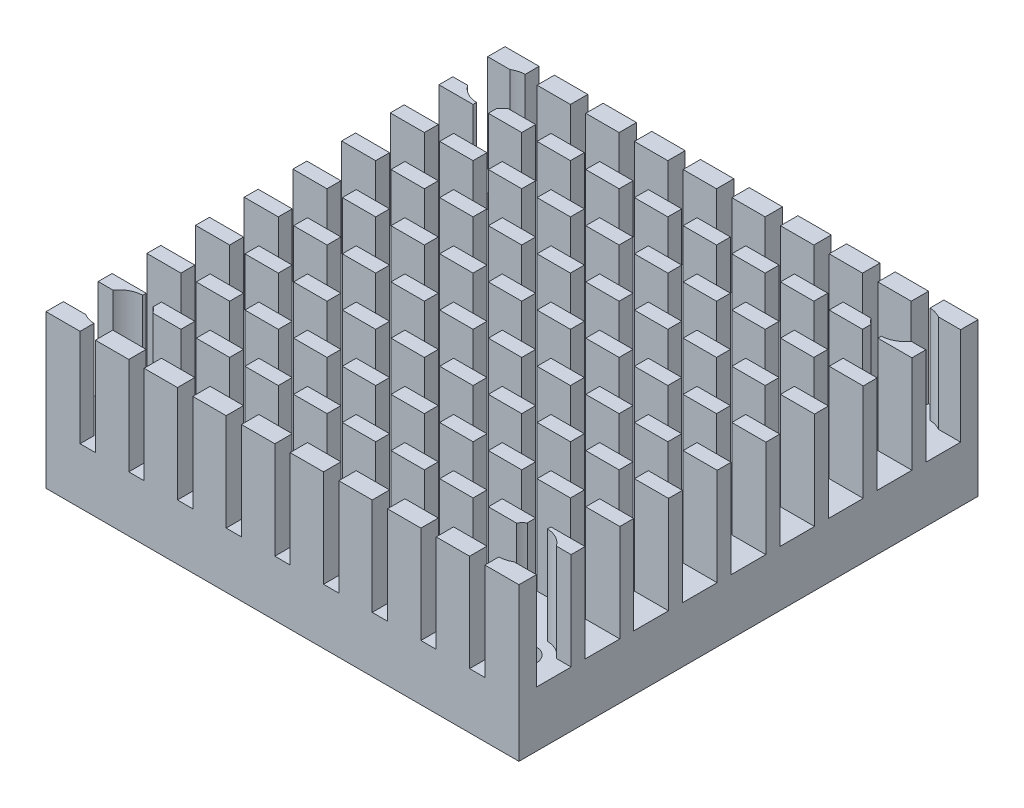
from build123d import *

# Parameters (mm, degrees)
ESQUISSE1_W             = 34
ESQUISSE1_H             = 33
BOSS_EXTRU_1_DEPTH      = 11
ENL_V_MAT_EXTRU_1_DEPTH = 7
ENL_V_MAT_EXTRU_2_DEPTH = 7
ENL_V_MAT_EXTRU_3_REACH = 26.703
ESQUISSE4_R             = 1


with BuildPart() as part:
    # Esquisse1 → Boss.-Extru.1 (new body)
    with BuildSketch(Plane(origin=(0, 0, 0), x_dir=(1, 0, 0), z_dir=(0, 1, 0))):
        Rectangle(ESQUISSE1_W, ESQUISSE1_H)
    extrude(amount=BOSS_EXTRU_1_DEPTH)

    # Esquisse2 → Enlèv. mat.-Extru.1 (cut)
    with BuildSketch(Plane(origin=(0, 11, 0), x_dir=(1, 0, 0), z_dir=(0, 1, 0))):
        with BuildLine():
            Line((-0.55, -17.5), (-0.55, 17.5))
            ThreePointArc((-0.55, 17.5), (0, 18.05), (0.55, 17.5))
            Line((0.55, 17.5), (0.55, -17.5))
            ThreePointArc((0.55, -17.5), (0, -18.05), (-0.55, -17.5))
        make_face()
        with BuildLine():
            Line((-4.05, -17.5), (-4.05, 17.5))
            ThreePointArc((-4.05, 17.5), (-3.5, 18.05), (-2.95, 17.5))
            Line((-2.95, 17.5), (-2.95, -17.5))
            ThreePointArc((-2.95, -17.5), (-3.5, -18.05), (-4.05, -17.5))
        make_face()
        with BuildLine():
            Line((-7.55, -17.5), (-7.55, 17.5))
            ThreePointArc((-7.55, 17.5), (-7, 18.05), (-6.45, 17.5))
            Line((-6.45, 17.5), (-6.45, -17.5))
            ThreePointArc((-6.45, -17.5), (-7, -18.05), (-7.55, -17.5))
        make_face()
        with BuildLine():
            Line((-11.05, -17.5), (-11.05, 17.5))
            ThreePointArc((-11.05, 17.5), (-10.5, 18.05), (-9.95, 17.5))
            Line((-9.95, 17.5), (-9.95, -17.5))
            ThreePointArc((-9.95, -17.5), (-10.5, -18.05), (-11.05, -17.5))
        make_face()
        with BuildLine():
            Line((-14.55, -17.5), (-14.55, -15.499285568))
            ThreePointArc((-14.55, -15.499285568), (-16.25, -13.75), (-14.55, -12.000714432))
            Line((-14.55, -12.000714432), (-14.55, 12.000714432))
            ThreePointArc((-14.55, 12.000714432), (-16.25, 13.75), (-14.55, 15.499285568))
            Line((-14.55, 15.499285568), (-14.55, 17.5))
            ThreePointArc((-14.55, 17.5), (-14, 18.05), (-13.45, 17.5))
            Line((-13.45, 17.5), (-13.45, 15.15))
            ThreePointArc((-13.45, 15.15), (-12.75, 13.75), (-13.45, 12.35))
            Line((-13.45, 12.35), (-13.45, -12.35))
            ThreePointArc((-13.45, -12.35), (-12.75, -13.75), (-13.45, -15.15))
            Line((-13.45, -15.15), (-13.45, -17.5))
            ThreePointArc((-13.45, -17.5), (-14, -18.05), (-14.55, -17.5))
        make_face()
        with BuildLine():
            Line((2.95, -17.5), (2.95, 17.5))
            ThreePointArc((2.95, 17.5), (3.5, 18.05), (4.05, 17.5))
            Line((4.05, 17.5), (4.05, -17.5))
            ThreePointArc((4.05, -17.5), (3.5, -18.05), (2.95, -17.5))
        make_face()
        with BuildLine():
            Line((6.45, -17.5), (6.45, 17.5))
            ThreePointArc((6.45, 17.5), (7, 18.05), (7.55, 17.5))
            Line((7.55, 17.5), (7.55, -17.5))
            ThreePointArc((7.55, -17.5), (7, -18.05), (6.45, -17.5))
        make_face()
        with BuildLine():
            Line((9.95, -17.5), (9.95, 17.5))
            ThreePointArc((9.95, 17.5), (10.5, 18.05), (11.05, 17.5))
            Line((11.05, 17.5), (11.05, -17.5))
            ThreePointArc((11.05, -17.5), (10.5, -18.05), (9.95, -17.5))
        make_face()
        with BuildLine():
            Line((13.45, -17.5), (13.45, -15.15))
            ThreePointArc((13.45, -15.15), (12.75, -13.75), (13.45, -12.35))
            Line((13.45, -12.35), (13.45, 12.35))
            ThreePointArc((13.45, 12.35), (12.75, 13.75), (13.45, 15.15))
            Line((13.45, 15.15), (13.45, 17.5))
            ThreePointArc((13.45, 17.5), (14, 18.05), (14.55, 17.5))
            Line((14.55, 17.5), (14.55, 15.499285568))
            ThreePointArc((14.55, 15.499285568), (16.25, 13.75), (14.55, 12.000714432))
            Line((14.55, 12.000714432), (14.55, -12.000714432))
            ThreePointArc((14.55, -12.000714432), (16.25, -13.75), (14.55, -15.499285568))
            Line((14.55, -15.499285568), (14.55, -17.5))
            ThreePointArc((14.55, -17.5), (14, -18.05), (13.45, -17.5))
        make_face()
    extrude(amount=-ENL_V_MAT_EXTRU_1_DEPTH, mode=Mode.SUBTRACT)

    # Esquisse3 → Enlèv. mat.-Extru.2 (cut)
    with BuildSketch(Plane(origin=(0, 11, 0), x_dir=(1, 0, 0), z_dir=(0, 1, 0))):
        with BuildLine():
            Line((18.84050419, -1.25), (-18.84050419, -1.25))
            ThreePointArc((-18.84050419, -1.25), (-20.09050419, 0), (-18.84050419, 1.25))
            Line((-18.84050419, 1.25), (18.84050419, 1.25))
            ThreePointArc((18.84050419, 1.25), (20.09050419, 0), (18.84050419, -1.25))
        make_face()
        with BuildLine():
            Line((18.84050419, 2.25), (-18.84050419, 2.25))
            ThreePointArc((-18.84050419, 2.25), (-20.09050419, 3.5), (-18.84050419, 4.75))
            Line((-18.84050419, 4.75), (18.84050419, 4.75))
            ThreePointArc((18.84050419, 4.75), (20.09050419, 3.5), (18.84050419, 2.25))
        make_face()
        with BuildLine():
            Line((18.84050419, 5.75), (-18.84050419, 5.75))
            ThreePointArc((-18.84050419, 5.75), (-20.09050419, 7), (-18.84050419, 8.25))
            Line((-18.84050419, 8.25), (18.84050419, 8.25))
            ThreePointArc((18.84050419, 8.25), (20.09050419, 7), (18.84050419, 5.75))
        make_face()
        with BuildLine():
            Line((18.84050419, 9.25), (-18.84050419, 9.25))
            ThreePointArc((-18.84050419, 9.25), (-20.09050419, 10.5), (-18.84050419, 11.75))
            Line((-18.84050419, 11.75), (18.84050419, 11.75))
            ThreePointArc((18.84050419, 11.75), (20.09050419, 10.5), (18.84050419, 9.25))
        make_face()
        with BuildLine():
            Line((18.84050419, 12.75), (-18.84050419, 12.75))
            ThreePointArc((-18.84050419, 12.75), (-20.09050419, 14), (-18.84050419, 15.25))
            Line((-18.84050419, 15.25), (18.84050419, 15.25))
            ThreePointArc((18.84050419, 15.25), (20.09050419, 14), (18.84050419, 12.75))
        make_face()
        with BuildLine():
            Line((18.84050419, -4.75), (-18.84050419, -4.75))
            ThreePointArc((-18.84050419, -4.75), (-20.09050419, -3.5), (-18.84050419, -2.25))
            Line((-18.84050419, -2.25), (18.84050419, -2.25))
            ThreePointArc((18.84050419, -2.25), (20.09050419, -3.5), (18.84050419, -4.75))
        make_face()
        with BuildLine():
            Line((18.84050419, -8.25), (-18.84050419, -8.25))
            ThreePointArc((-18.84050419, -8.25), (-20.09050419, -7), (-18.84050419, -5.75))
            Line((-18.84050419, -5.75), (18.84050419, -5.75))
            ThreePointArc((18.84050419, -5.75), (20.09050419, -7), (18.84050419, -8.25))
        make_face()
        with BuildLine():
            Line((18.84050419, -11.75), (-18.84050419, -11.75))
            ThreePointArc((-18.84050419, -11.75), (-20.09050419, -10.5), (-18.84050419, -9.25))
            Line((-18.84050419, -9.25), (18.84050419, -9.25))
            ThreePointArc((18.84050419, -9.25), (20.09050419, -10.5), (18.84050419, -11.75))
        make_face()
        with BuildLine():
            Line((18.84050419, -15.25), (-18.84050419, -15.25))
            ThreePointArc((-18.84050419, -15.25), (-20.09050419, -14), (-18.84050419, -12.75))
            Line((-18.84050419, -12.75), (18.84050419, -12.75))
            ThreePointArc((18.84050419, -12.75), (20.09050419, -14), (18.84050419, -15.25))
        make_face()
    extrude(amount=-ENL_V_MAT_EXTRU_2_DEPTH, mode=Mode.SUBTRACT)

    # Esquisse4 → Enlèv. mat.-Extru.3 (cut, up to next)
    with BuildSketch(Plane(origin=(0, 4, 0), x_dir=(1, 0, 0), z_dir=(0, 1, 0)), mode=Mode.PRIVATE) as enl_v_mat_extru_3_sk1:
        with Locations((-14.5, 13.75)):
            Circle(ESQUISSE4_R)
    enl_v_mat_extru_3_tool1 = extrude(enl_v_mat_extru_3_sk1.sketch, amount=-ENL_V_MAT_EXTRU_3_REACH, mode=Mode.PRIVATE) & part.part
    # Esquisse4 → Enlèv. mat.-Extru.3 (cut, up to next)
    with BuildSketch(Plane(origin=(0, 4, 0), x_dir=(1, 0, 0), z_dir=(0, 1, 0)), mode=Mode.PRIVATE) as enl_v_mat_extru_3_sk2:
        with Locations((14.5, 13.75)):
            Circle(ESQUISSE4_R)
    enl_v_mat_extru_3_tool2 = extrude(enl_v_mat_extru_3_sk2.sketch, amount=-ENL_V_MAT_EXTRU_3_REACH, mode=Mode.PRIVATE) & part.part
    # Esquisse4 → Enlèv. mat.-Extru.3 (cut, up to next)
    with BuildSketch(Plane(origin=(0, 4, 0), x_dir=(1, 0, 0), z_dir=(0, 1, 0)), mode=Mode.PRIVATE) as enl_v_mat_extru_3_sk3:
        with Locations((14.5, -13.75)):
            Circle(ESQUISSE4_R)
    enl_v_mat_extru_3_tool3 = extrude(enl_v_mat_extru_3_sk3.sketch, amount=-ENL_V_MAT_EXTRU_3_REACH, mode=Mode.PRIVATE) & part.part
    # Esquisse4 → Enlèv. mat.-Extru.3 (cut, up to next)
    with BuildSketch(Plane(origin=(0, 4, 0), x_dir=(1, 0, 0), z_dir=(0, 1, 0)), mode=Mode.PRIVATE) as enl_v_mat_extru_3_sk4:
        with Locations((-14.5, -13.75)):
            Circle(ESQUISSE4_R)
    enl_v_mat_extru_3_tool4 = extrude(enl_v_mat_extru_3_sk4.sketch, amount=-ENL_V_MAT_EXTRU_3_REACH, mode=Mode.PRIVATE) & part.part
    add(enl_v_mat_extru_3_tool1.solids().sort_by_distance((-14.5, 4, -13.75))[0], mode=Mode.SUBTRACT)
    add(enl_v_mat_extru_3_tool2.solids().sort_by_distance((14.5, 4, -13.75))[0], mode=Mode.SUBTRACT)
    add(enl_v_mat_extru_3_tool3.solids().sort_by_distance((14.5, 4, 13.75))[0], mode=Mode.SUBTRACT)
    add(enl_v_mat_extru_3_tool4.solids().sort_by_distance((-14.5, 4, 13.75))[0], mode=Mode.SUBTRACT)


solid = part.part
